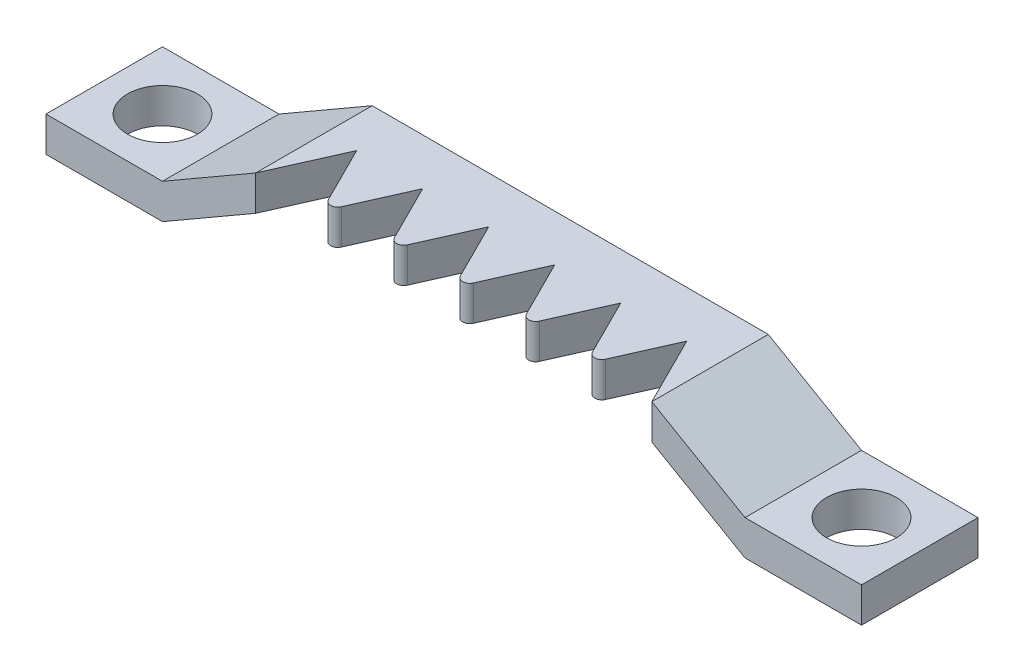
from build123d import *

# Parameters (mm, degrees)
BASE_EXTRUDE_DEPTH = 6.35
HOLE_CUTS_REACH    = 47.161
SKETCH2_R          = 1.905
TEETH_CUTS_REACH   = 47.161
TEETH_FILLET_R     = 0.381


with BuildPart() as part:
    # Sketch1 → Base Extrude (new body)
    with BuildSketch(Plane.XY):
        Polygon((0, 0), (6.35, 0), (11.43, 2.932939367), (33.02, 2.932939367), (38.1, 0), (44.45, 0), (44.45, 1.905), (38.1, 1.905), (33.02, 4.837939367), (11.43, 4.837939367), (6.35, 1.905), (0, 1.905), align=None)
    extrude(amount=BASE_EXTRUDE_DEPTH)

    # Sketch2 → Hole Cuts (cut, up to next)
    with BuildSketch(Plane(origin=(0, 4.837939367, 0), x_dir=(1, 0, 0), z_dir=(0, 1, 0)), mode=Mode.PRIVATE) as hole_cuts_sk1:
        with Locations(Location((41.275, -3.175, 0), (0, 0, 270))):
            Circle(SKETCH2_R)
    hole_cuts_tool1 = extrude(hole_cuts_sk1.sketch, amount=-HOLE_CUTS_REACH, mode=Mode.PRIVATE) & part.part
    # Sketch2 → Hole Cuts (cut, up to next)
    with BuildSketch(Plane(origin=(0, 4.837939367, 0), x_dir=(1, 0, 0), z_dir=(0, 1, 0)), mode=Mode.PRIVATE) as hole_cuts_sk2:
        with Locations(Location((3.175, -3.175, 0), (0, 0, 180))):
            Circle(SKETCH2_R)
    hole_cuts_tool2 = extrude(hole_cuts_sk2.sketch, amount=-HOLE_CUTS_REACH, mode=Mode.PRIVATE) & part.part
    add(hole_cuts_tool1.solids().sort_by_distance((41.275, 4.837939, 3.175))[0], mode=Mode.SUBTRACT)
    add(hole_cuts_tool2.solids().sort_by_distance((3.175, 4.837939, 3.175))[0], mode=Mode.SUBTRACT)

    # Sketch3 → Teeth Cuts (cut, up to next)
    with BuildSketch(Plane(origin=(0, 4.837939367, 0), x_dir=(1, 0, 0), z_dir=(0, 1, 0)), mode=Mode.PRIVATE) as teeth_cuts_sk1:
        Polygon((25.823333333, -6.35), (29.421666667, -6.35), (27.516666667, -2.54), align=None)
    teeth_cuts_tool1 = extrude(teeth_cuts_sk1.sketch, amount=-TEETH_CUTS_REACH, mode=Mode.PRIVATE) & part.part
    # Sketch3 → Teeth Cuts (cut, up to next)
    with BuildSketch(Plane(origin=(0, 4.837939367, 0), x_dir=(1, 0, 0), z_dir=(0, 1, 0)), mode=Mode.PRIVATE) as teeth_cuts_sk2:
        Polygon((29.421666667, -6.35), (33.02, -6.35), (31.115, -2.54), align=None)
    teeth_cuts_tool2 = extrude(teeth_cuts_sk2.sketch, amount=-TEETH_CUTS_REACH, mode=Mode.PRIVATE) & part.part
    # Sketch3 → Teeth Cuts (cut, up to next)
    with BuildSketch(Plane(origin=(0, 4.837939367, 0), x_dir=(1, 0, 0), z_dir=(0, 1, 0)), mode=Mode.PRIVATE) as teeth_cuts_sk3:
        Polygon((22.225, -6.35), (25.823333333, -6.35), (23.918333333, -2.54), align=None)
    teeth_cuts_tool3 = extrude(teeth_cuts_sk3.sketch, amount=-TEETH_CUTS_REACH, mode=Mode.PRIVATE) & part.part
    # Sketch3 → Teeth Cuts (cut, up to next)
    with BuildSketch(Plane(origin=(0, 4.837939367, 0), x_dir=(1, 0, 0), z_dir=(0, 1, 0)), mode=Mode.PRIVATE) as teeth_cuts_sk4:
        Polygon((18.626666667, -6.35), (22.225, -6.35), (20.32, -2.54), align=None)
    teeth_cuts_tool4 = extrude(teeth_cuts_sk4.sketch, amount=-TEETH_CUTS_REACH, mode=Mode.PRIVATE) & part.part
    # Sketch3 → Teeth Cuts (cut, up to next)
    with BuildSketch(Plane(origin=(0, 4.837939367, 0), x_dir=(1, 0, 0), z_dir=(0, 1, 0)), mode=Mode.PRIVATE) as teeth_cuts_sk5:
        Polygon((15.028333333, -6.35), (18.626666667, -6.35), (16.721666667, -2.54), align=None)
    teeth_cuts_tool5 = extrude(teeth_cuts_sk5.sketch, amount=-TEETH_CUTS_REACH, mode=Mode.PRIVATE) & part.part
    # Sketch3 → Teeth Cuts (cut, up to next)
    with BuildSketch(Plane(origin=(0, 4.837939367, 0), x_dir=(1, 0, 0), z_dir=(0, 1, 0)), mode=Mode.PRIVATE) as teeth_cuts_sk6:
        Polygon((11.43, -6.35), (15.028333333, -6.35), (13.123333333, -2.54), align=None)
    teeth_cuts_tool6 = extrude(teeth_cuts_sk6.sketch, amount=-TEETH_CUTS_REACH, mode=Mode.PRIVATE) & part.part
    add(teeth_cuts_tool1.solids().sort_by_distance((27.587222, 4.837939, 5.08))[0], mode=Mode.SUBTRACT)
    add(teeth_cuts_tool2.solids().sort_by_distance((31.185556, 4.837939, 5.08))[0], mode=Mode.SUBTRACT)
    add(teeth_cuts_tool3.solids().sort_by_distance((23.988889, 4.837939, 5.08))[0], mode=Mode.SUBTRACT)
    add(teeth_cuts_tool4.solids().sort_by_distance((20.390556, 4.837939, 5.08))[0], mode=Mode.SUBTRACT)
    add(teeth_cuts_tool5.solids().sort_by_distance((16.792222, 4.837939, 5.08))[0], mode=Mode.SUBTRACT)
    add(teeth_cuts_tool6.solids().sort_by_distance((13.193889, 4.837939, 5.08))[0], mode=Mode.SUBTRACT)

    # Teeth Fillet
    teeth_fillet_edges = [part.edges().sort_by_distance(p)[0] for p in [
        (29.421666667, 3.885439367, 6.35),
        (25.823333333, 3.885439367, 6.35),
        (18.626666667, 3.885439367, 6.35),
        (22.225, 3.885439367, 6.35),
        (15.028333333, 3.885439367, 6.35),
    ]]
    fillet(teeth_fillet_edges, radius=TEETH_FILLET_R)


solid = part.part
